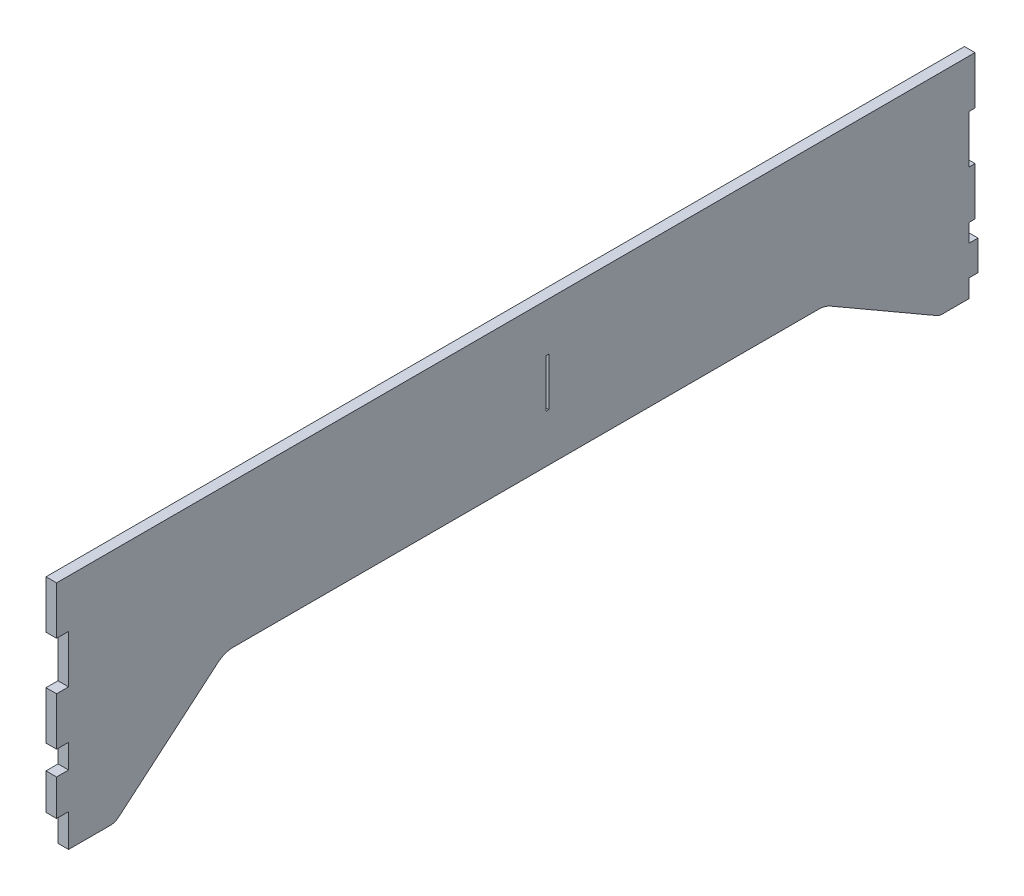
from build123d import *

# Parameters (mm, degrees)
SKETCH1_W           = 25.4
SKETCH1_H           = 1.5875
BOSS_EXTRUDE1_DEPTH = 5.588


with BuildPart() as part:
    # Sketch1 → Boss-Extrude1 (new body)
    # profile 1 of 3: a face of its own
    with BuildSketch(Plane(origin=(-94.488, 0, 0), x_dir=(0, -1, 0), z_dir=(-1, 0, 0))):
        Polygon((136.525, -196.85), (111.125, -196.85), (111.125, -203.2), (85.725, -203.2), (85.725, -196.85), (60.325, -196.85), (60.325, -682.625), (85.725, -682.625), (85.725, -679.45), (111.125, -679.45), (111.125, -682.625), (136.525, -682.625), align=None)
        with Locations((98.425, -456.40625)):
            Rectangle(SKETCH1_W, SKETCH1_H, mode=Mode.SUBTRACT)
    # profile 2 of 3: a face of its own
    with BuildSketch(Plane(origin=(-94.488, 0, 0), x_dir=(0, -1, 0), z_dir=(-1, 0, 0))):
        with BuildLine():
            Line((149.225, -203.2), (136.525, -203.2))
            Line((136.525, -203.2), (136.525, -290.406498707))
            ThreePointArc((136.525, -290.406498707), (137.30121982, -286.034603668), (139.534994681, -282.197126202))
            Line((139.534994681, -282.197126202), (184.118202659, -229.57294303))
            ThreePointArc((184.118202659, -229.57294303), (185.23509009, -227.654204297), (185.6232, -225.468256778))
            Line((185.6232, -225.468256778), (185.6232, -203.2))
            Line((185.6232, -203.2), (168.275, -203.2))
            Line((168.275, -203.2), (168.275, -196.85))
            Line((168.275, -196.85), (149.225, -196.85))
            Line((149.225, -196.85), (149.225, -203.2))
        make_face()
    # profile 3 of 3: a face of its own
    with BuildSketch(Plane(origin=(-94.488, 0, 0), x_dir=(0, -1, 0), z_dir=(-1, 0, 0))):
        with BuildLine():
            ThreePointArc((138.226477372, -606.197045256), (136.957742006, -603.134047129), (136.525, -599.847045256))
            Line((136.525, -599.847045256), (136.525, -679.45))
            Line((136.525, -679.45), (146.05, -679.45))
            Line((146.05, -679.45), (146.05, -684.2125))
            Line((146.05, -684.2125), (161.925, -684.2125))
            Line((161.925, -684.2125), (161.925, -679.45))
            Line((161.925, -679.45), (171.45, -679.45))
            Line((171.45, -679.45), (171.45, -665.443351826))
            ThreePointArc((171.45, -665.443351826), (171.233628997, -663.79985089), (170.599261314, -662.268351826))
            Line((170.599261314, -662.268351826), (138.226477372, -606.197045256))
        make_face()
    extrude(amount=-BOSS_EXTRUDE1_DEPTH)


solid = part.part
